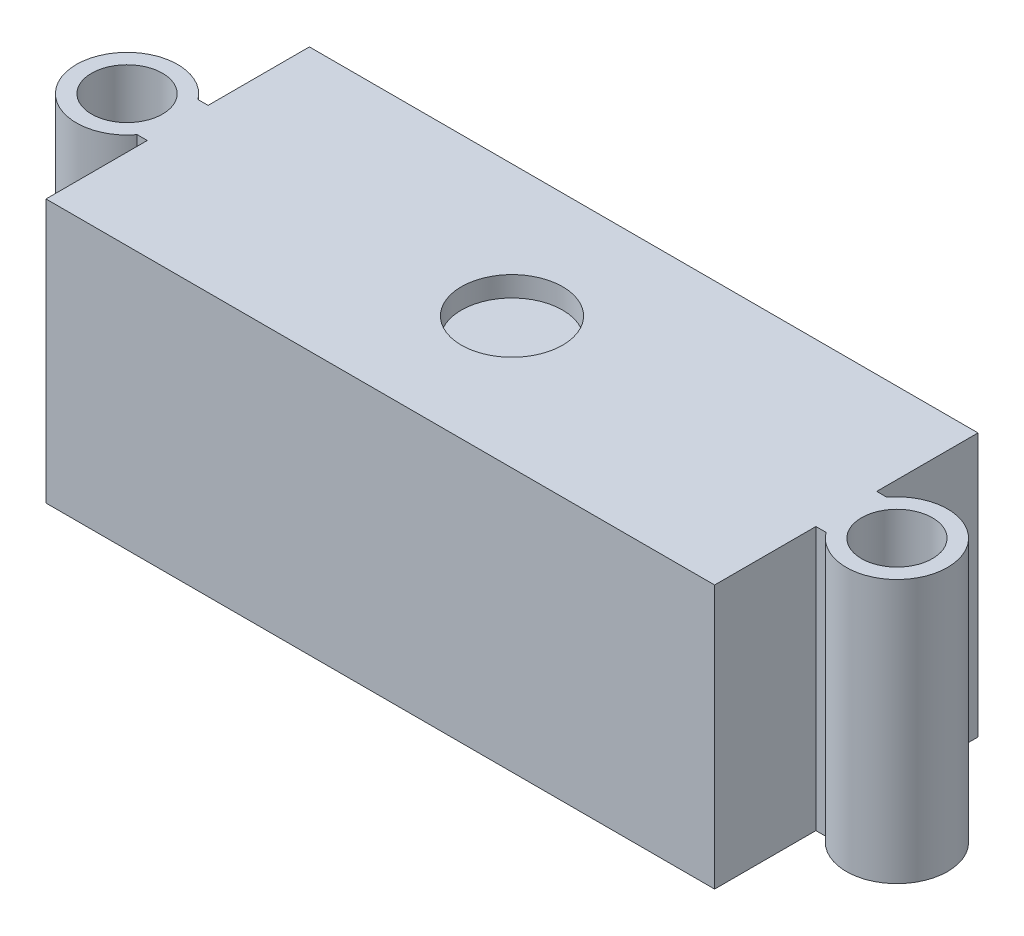
from build123d import *

# Parameters (mm, degrees)
BOSS_EXTRUDE2_DEPTH = 10
BOSS_EXTRUDE3_DEPTH = 11
SKETCH3_W           = 1
SKETCH3_H           = 13
BOSS_EXTRUDE4_DEPTH = 33
SKETCH4_R           = 1.75
BOSS_EXTRUDE5_DEPTH = 13
SKETCH5_R           = 2.5
CUT_EXTRUDE1_DEPTH  = 1.5


with BuildPart() as part:
    # Sketch1 → Boss-Extrude2 (new body)
    with BuildSketch(Plane.XY):
        with BuildLine():
            Line((-15, 0), (15, 0))
            Line((15, 0), (15, 1.5))
            ThreePointArc((15, 1.5), (11.5, 5), (15, 8.5))
            Line((15, 8.5), (15, 10))
            Line((15, 10), (-15, 10))
            Line((-15, 10), (-15, 8.5))
            ThreePointArc((-15, 8.5), (-11.5, 5), (-15, 1.5))
            Line((-15, 1.5), (-15, 0))
        make_face()
    extrude(amount=BOSS_EXTRUDE2_DEPTH)


with BuildPart() as body_2:
    # Sketch2 → Boss-Extrude3 (new body)
    # profile 1 of 3: a face of its own
    with BuildSketch(Plane(origin=(0, 0, -0.5), x_dir=(-1, 0, 0), z_dir=(0, 0, -1))):
        with BuildLine():
            Line((15, 3), (16.5, 3))
            Line((16.5, 3), (16.5, -1.5))
            Line((16.5, -1.5), (0, -1.5))
            Line((0, -1.5), (-16.5, -1.5))
            Line((-16.5, -1.5), (-16.5, 3))
            Line((-16.5, 3), (-15, 3))
            ThreePointArc((-15, 3), (-13, 5), (-15, 7))
            Line((-15, 7), (-16.5, 7))
            Line((-16.5, 7), (-16.5, 11.5))
            Line((-16.5, 11.5), (0, 11.5))
            Line((0, 11.5), (16.5, 11.5))
            Line((16.5, 11.5), (16.5, 7))
            Line((16.5, 7), (15, 7))
            ThreePointArc((15, 7), (13, 5), (15, 3))
        make_face()
        with BuildLine():
            ThreePointArc((15, 2), (12, 5), (15, 8))
            Line((15, 8), (15.5, 8))
            Line((15.5, 8), (15.5, 10.5))
            Line((15.5, 10.5), (0, 10.5))
            Line((0, 10.5), (-15.5, 10.5))
            Line((-15.5, 10.5), (-15.5, 8))
            Line((-15.5, 8), (-15, 8))
            ThreePointArc((-15, 8), (-12, 5), (-15, 2))
            Line((-15, 2), (-15.5, 2))
            Line((-15.5, 2), (-15.5, -0.5))
            Line((-15.5, -0.5), (0, -0.5))
            Line((0, -0.5), (15.5, -0.5))
            Line((15.5, -0.5), (15.5, 2))
            Line((15.5, 2), (15, 2))
        make_face(mode=Mode.SUBTRACT)
    # profile 2 of 3: a face of its own
    with BuildSketch(Plane(origin=(0, 0, -0.5), x_dir=(-1, 0, 0), z_dir=(0, 0, -1))):
        with BuildLine():
            ThreePointArc((15, 3), (13, 5), (15, 7))
            Line((15, 7), (16.5, 7))
            Line((16.5, 7), (16.5, 3))
            Line((16.5, 3), (15, 3))
        make_face()
    # profile 3 of 3: a face of its own
    with BuildSketch(Plane(origin=(0, 0, -0.5), x_dir=(-1, 0, 0), z_dir=(0, 0, -1))):
        with BuildLine():
            Line((-15, 3), (-16.5, 3))
            Line((-16.5, 3), (-16.5, 7))
            Line((-16.5, 7), (-15, 7))
            ThreePointArc((-15, 7), (-13, 5), (-15, 3))
        make_face()
    extrude(amount=-BOSS_EXTRUDE3_DEPTH)

    # Sketch3 → Boss-Extrude4 (add)
    with BuildSketch(Plane(origin=(16.5, 0, 0), x_dir=(0, 0, -1), z_dir=(1, 0, 0))):
        with Locations((1, 5)):
            Rectangle(SKETCH3_W, SKETCH3_H)
        with Locations((-11, 5)):
            Rectangle(SKETCH3_W, SKETCH3_H)
    extrude(amount=-BOSS_EXTRUDE4_DEPTH)

    # Sketch4 → Boss-Extrude5 (add)
    # profile 1 of 8: a face of its own
    with BuildSketch(Plane(origin=(0, 11.5, 0), x_dir=(1, 0, 0), z_dir=(0, 1, 0))):
        with BuildLine():
            Line((-17.1, -3.5), (-17, -3.5))
            ThreePointArc((-17, -3.5), (-21.5, -5), (-17, -6.5))
            Line((-17, -6.5), (-17.1, -6.5))
            Line((-17.1, -6.5), (-17.1, -3.5))
        make_face()
        with Locations(Location((-19, -5, 0), (0, 0, 270))):
            Circle(SKETCH4_R, mode=Mode.SUBTRACT)
    # profile 2 of 8: a face of its own
    with BuildSketch(Plane(origin=(0, 11.5, 0), x_dir=(1, 0, 0), z_dir=(0, 1, 0))):
        with BuildLine():
            ThreePointArc((-16.5, -5), (-16.628291755, -4.209430585), (-17, -3.5))
            Line((-17, -3.5), (-17.1, -3.5))
            Line((-17.1, -3.5), (-17.1, -6.5))
            Line((-17.1, -6.5), (-17, -6.5))
            ThreePointArc((-17, -6.5), (-16.628291755, -5.790569415), (-16.5, -5))
        make_face()
    # profile 3 of 8: a face of its own
    with BuildSketch(Plane(origin=(0, 11.5, 0), x_dir=(1, 0, 0), z_dir=(0, 1, 0))):
        with BuildLine():
            Line((-16.5, -6.5), (-16.5, -5))
            ThreePointArc((-16.5, -5), (-16.628291755, -5.790569415), (-17, -6.5))
            Line((-17, -6.5), (-16.5, -6.5))
        make_face()
    # profile 4 of 8: a face of its own
    with BuildSketch(Plane(origin=(0, 11.5, 0), x_dir=(1, 0, 0), z_dir=(0, 1, 0))):
        with BuildLine():
            Line((-16.5, -5), (-16.5, -3.5))
            Line((-16.5, -3.5), (-17, -3.5))
            ThreePointArc((-17, -3.5), (-16.628291755, -4.209430585), (-16.5, -5))
        make_face()
    # profile 5 of 8: a face of its own
    with BuildSketch(Plane(origin=(0, 11.5, 0), x_dir=(1, 0, 0), z_dir=(0, 1, 0))):
        with BuildLine():
            ThreePointArc((16.5, -5), (16.628291755, -5.790569415), (17, -6.5))
            Line((17, -6.5), (17.1, -6.5))
            Line((17.1, -6.5), (17.1, -3.5))
            Line((17.1, -3.5), (17, -3.5))
            ThreePointArc((17, -3.5), (16.628291755, -4.209430585), (16.5, -5))
        make_face()
    # profile 6 of 8: a face of its own
    with BuildSketch(Plane(origin=(0, 11.5, 0), x_dir=(1, 0, 0), z_dir=(0, 1, 0))):
        with BuildLine():
            Line((16.5, -3.5), (16.5, -5))
            ThreePointArc((16.5, -5), (16.628291755, -4.209430585), (17, -3.5))
            Line((17, -3.5), (16.5, -3.5))
        make_face()
    # profile 7 of 8: a face of its own
    with BuildSketch(Plane(origin=(0, 11.5, 0), x_dir=(1, 0, 0), z_dir=(0, 1, 0))):
        with BuildLine():
            Line((16.5, -5), (16.5, -6.5))
            Line((16.5, -6.5), (17, -6.5))
            ThreePointArc((17, -6.5), (16.628291755, -5.790569415), (16.5, -5))
        make_face()
    # profile 8 of 8: a face of its own
    with BuildSketch(Plane(origin=(0, 11.5, 0), x_dir=(1, 0, 0), z_dir=(0, 1, 0))):
        with BuildLine():
            Line((17.1, -6.5), (17, -6.5))
            ThreePointArc((17, -6.5), (19.790569415, -7.371708245), (21.5, -5))
            ThreePointArc((21.5, -5), (19.790569415, -2.628291755), (17, -3.5))
            Line((17, -3.5), (17.1, -3.5))
            Line((17.1, -3.5), (17.1, -6.5))
        make_face()
        with Locations(Location((19, -5, 0), (0, 0, 270))):
            Circle(SKETCH4_R, mode=Mode.SUBTRACT)
    extrude(amount=-BOSS_EXTRUDE5_DEPTH)

    # Sketch5 → Cut-Extrude1 (cut)
    with BuildSketch(Plane(origin=(0, 10, 0), x_dir=(1, 0, 0), z_dir=(0, 1, 0))):
        with Locations(Location((0, -5, 0), (0, 0, 90))):
            Circle(SKETCH5_R)
    extrude(amount=CUT_EXTRUDE1_DEPTH, mode=Mode.SUBTRACT)


solid = Compound([part.part, body_2.part])
